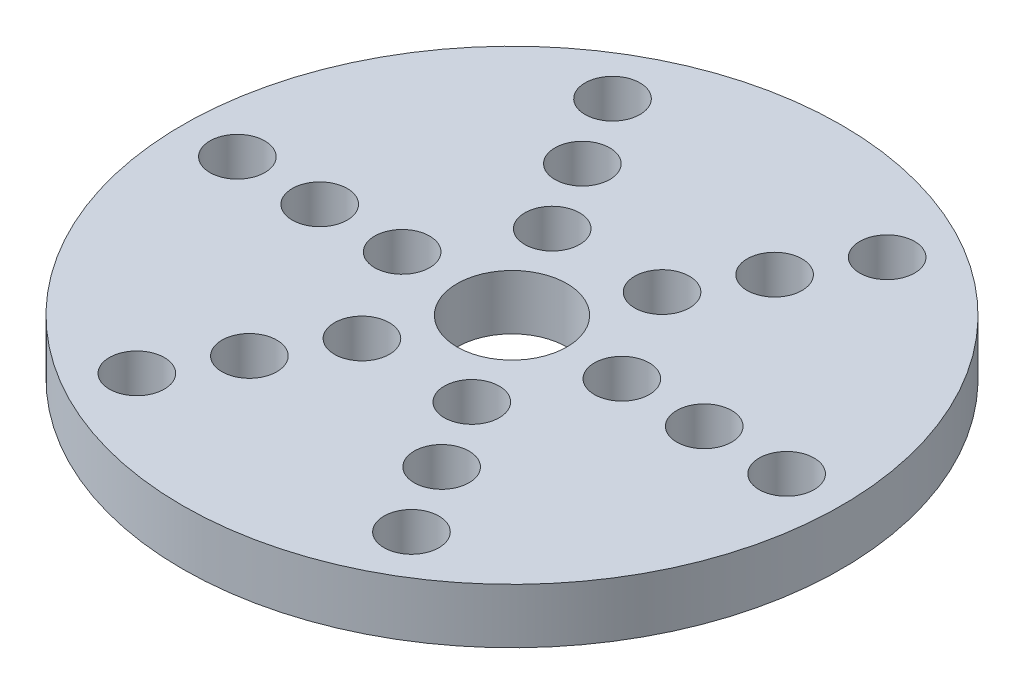
from build123d import *

# Parameters (mm, degrees)
SKETCH1_R           = 60
SKETCH1_R_2         = 10
SKETCH1_R_3         = 5
BOSS_EXTRUDE1_DEPTH = 10


with BuildPart() as part:
    # Sketch1 → Boss-Extrude1 (new body)
    with BuildSketch(Plane(origin=(0, 0, 0), x_dir=(1, 0, 0), z_dir=(0, 1, 0))):
        with Locations(Location((0, 0, 0), (0, 0, 270))):
            Circle(SKETCH1_R)
        with Locations(Location((0, 0, 0), (0, 0, 270))):
            Circle(SKETCH1_R_2, mode=Mode.SUBTRACT)
        with Locations(Location((-20, 0, 0), (0, 0, 270))):
            Circle(SKETCH1_R_3, mode=Mode.SUBTRACT)
        with Locations(Location((-35, 0, 0), (0, 0, 270))):
            Circle(SKETCH1_R_3, mode=Mode.SUBTRACT)
        with Locations(Location((-50, 0, 0), (0, 0, 270))):
            Circle(SKETCH1_R_3, mode=Mode.SUBTRACT)
        with Locations(Location((-10, 17.320508076, 0), (0, 0, 270))):
            Circle(SKETCH1_R_3, mode=Mode.SUBTRACT)
        with Locations(Location((10, 17.320508076, 0), (0, 0, 270))):
            Circle(SKETCH1_R_3, mode=Mode.SUBTRACT)
        with Locations(Location((20, 0, 0), (0, 0, 270))):
            Circle(SKETCH1_R_3, mode=Mode.SUBTRACT)
        with Locations(Location((10, -17.320508076, 0), (0, 0, 270))):
            Circle(SKETCH1_R_3, mode=Mode.SUBTRACT)
        with Locations(Location((-10, -17.320508076, 0), (0, 0, 270))):
            Circle(SKETCH1_R_3, mode=Mode.SUBTRACT)
        with Locations(Location((-17.5, 30.310889132, 0), (0, 0, 270))):
            Circle(SKETCH1_R_3, mode=Mode.SUBTRACT)
        with Locations(Location((17.5, 30.310889132, 0), (0, 0, 270))):
            Circle(SKETCH1_R_3, mode=Mode.SUBTRACT)
        with Locations(Location((35, 0, 0), (0, 0, 270))):
            Circle(SKETCH1_R_3, mode=Mode.SUBTRACT)
        with Locations(Location((17.5, -30.310889132, 0), (0, 0, 270))):
            Circle(SKETCH1_R_3, mode=Mode.SUBTRACT)
        with Locations(Location((-17.5, -30.310889132, 0), (0, 0, 270))):
            Circle(SKETCH1_R_3, mode=Mode.SUBTRACT)
        with Locations(Location((-25, 43.301270189, 0), (0, 0, 270))):
            Circle(SKETCH1_R_3, mode=Mode.SUBTRACT)
        with Locations(Location((25, 43.301270189, 0), (0, 0, 270))):
            Circle(SKETCH1_R_3, mode=Mode.SUBTRACT)
        with Locations(Location((50, 0, 0), (0, 0, 270))):
            Circle(SKETCH1_R_3, mode=Mode.SUBTRACT)
        with Locations(Location((25, -43.301270189, 0), (0, 0, 270))):
            Circle(SKETCH1_R_3, mode=Mode.SUBTRACT)
        with Locations(Location((-25, -43.301270189, 0), (0, 0, 270))):
            Circle(SKETCH1_R_3, mode=Mode.SUBTRACT)
    extrude(amount=BOSS_EXTRUDE1_DEPTH)


solid = part.part
